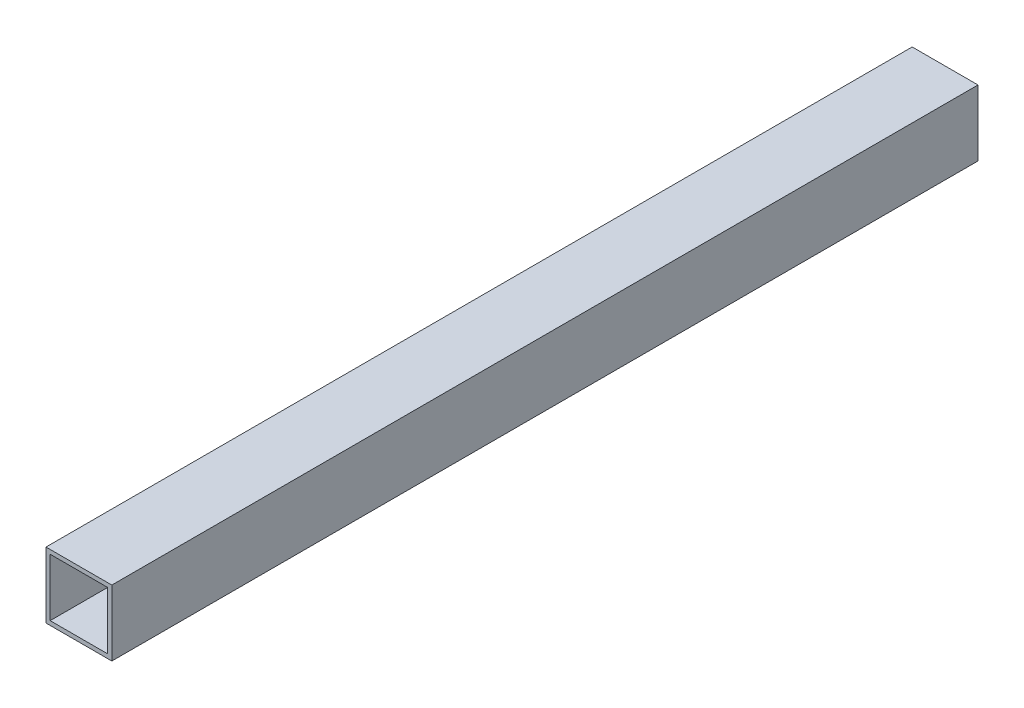
from build123d import *

# Parameters (mm, degrees)
SKETCH1_W           = 19
SKETCH1_H           = 19
SKETCH1_W_2         = 16.6
SKETCH1_H_2         = 16.6
BOSS_EXTRUDE1_DEPTH = 250


with BuildPart() as part:
    # Sketch1 → Boss-Extrude1 (new body)
    with BuildSketch(Plane.XY):
        Rectangle(SKETCH1_W, SKETCH1_H)
        Rectangle(SKETCH1_W_2, SKETCH1_H_2, mode=Mode.SUBTRACT)
    extrude(amount=BOSS_EXTRUDE1_DEPTH)


solid = part.part
